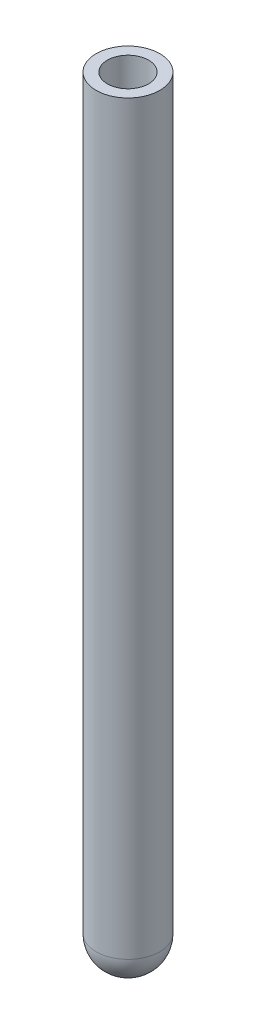
from build123d import *

# Parameters (mm, degrees)
FILLET1_R = 0.5


with BuildPart() as part:
    # Sketch1 → Revolve1 (revolve)
    with BuildSketch(Plane(origin=(0, 0, 0), x_dir=(0, 0, -1), z_dir=(1, 0, 0)), mode=Mode.PRIVATE) as revolve1_sk:
        Polygon((0.33, 0), (0.33, -10), (0, -10), (0, -12.45), (0.51, -12.45), (0.51, 0), align=None)
    revolve(revolve1_sk.sketch.rotate(Axis((0, -10, 0), (0, -1, 0)), 180), axis=Axis((0, -10, 0), (0, -1, 0)))

    # Fillet1
    fillet1_edges = [part.edges().sort_by_distance(p)[0] for p in [
        (0, -12.45, -0.51),
    ]]
    fillet(fillet1_edges, radius=FILLET1_R)


solid = part.part
